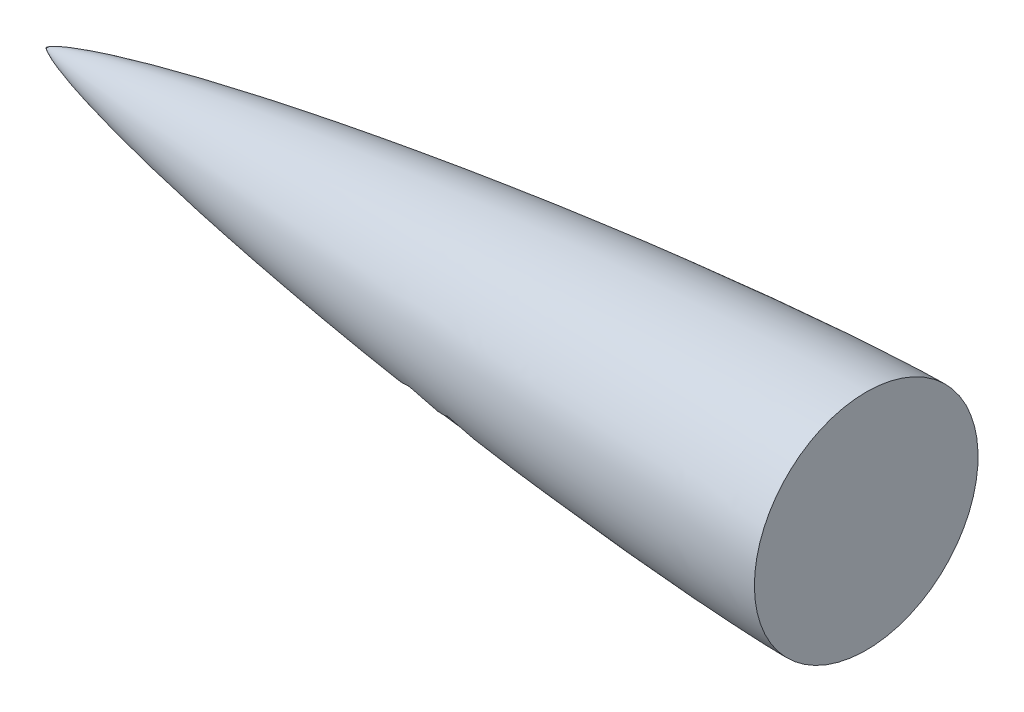
from build123d import *


with BuildPart() as part:
    # Sketch9 → Revolve9 (revolve)
    with BuildSketch(Plane.XY):
        with BuildLine():
            Line((0, 0), (22, 0))
            Line((22, 0), (22, 3))
            add(Edge.make_bspline(
                [(0, 0), (0.001798545, 0.003445296), (0.006056808, 0.009146438), (0.014192433, 0.015981523), (0.026148475, 0.02528387), (0.041443991, 0.035551733), (0.064887049, 0.049845858), (0.104547333, 0.071333169), (0.173882111, 0.104552989), (0.299619218, 0.157330328), (0.526300183, 0.239817571), (0.901842414, 0.357899227), (1.578411328, 0.542669502), (2.534220573, 0.766107402), (3.720375229, 1.00978138), (5.081975452, 1.259062818), (6.44977929, 1.486902659), (7.820476591, 1.696624693), (9.193463064, 1.890694291), (10.568391193, 2.070493826), (11.944996174, 2.236936402), (13.323108763, 2.390390056), (14.702598258, 2.530950105), (16.083379205, 2.658178301), (17.46539112, 2.771376539), (18.848602165, 2.868800459), (20.155093557, 2.943615894), (21.116261891, 2.982792009), (21.731381795, 2.998273385), (22, 3)],
                knots=[0, 0, 0, 0, 0, 0.00069589, 0.00128541, 0.001879248, 0.002733001, 0.003996058, 0.006218533, 0.00997402, 0.01653614, 0.028474831, 0.049524306, 0.080651137, 0.142462052, 0.204715747, 0.266969441, 0.329223139, 0.391476838, 0.453730536, 0.515984234, 0.578237931, 0.640491631, 0.702745327, 0.764999027, 0.827252724, 0.889506423, 0.951760122, 1, 1, 1, 1, 1], degree=4))
        make_face()
    revolve(axis=Axis((0, 0, 0), (1, 0, 0)))


solid = part.part
